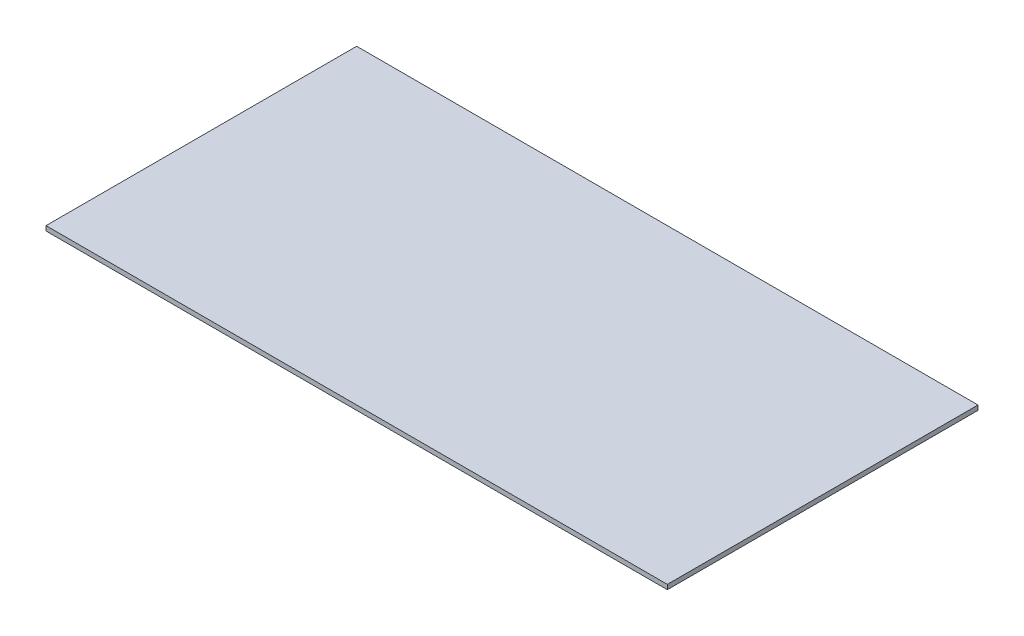
from build123d import *

# Parameters (mm, degrees)
SKETCH1_W           = 400
SKETCH1_H           = 200
BOSS_EXTRUDE1_DEPTH = 3


with BuildPart() as part:
    # Sketch1 → Boss-Extrude1 (new body)
    with BuildSketch(Plane(origin=(0, 0, 0), x_dir=(1, 0, 0), z_dir=(0, 1, 0))):
        with Locations((200, 100)):
            Rectangle(SKETCH1_W, SKETCH1_H)
    extrude(amount=BOSS_EXTRUDE1_DEPTH)


solid = part.part
